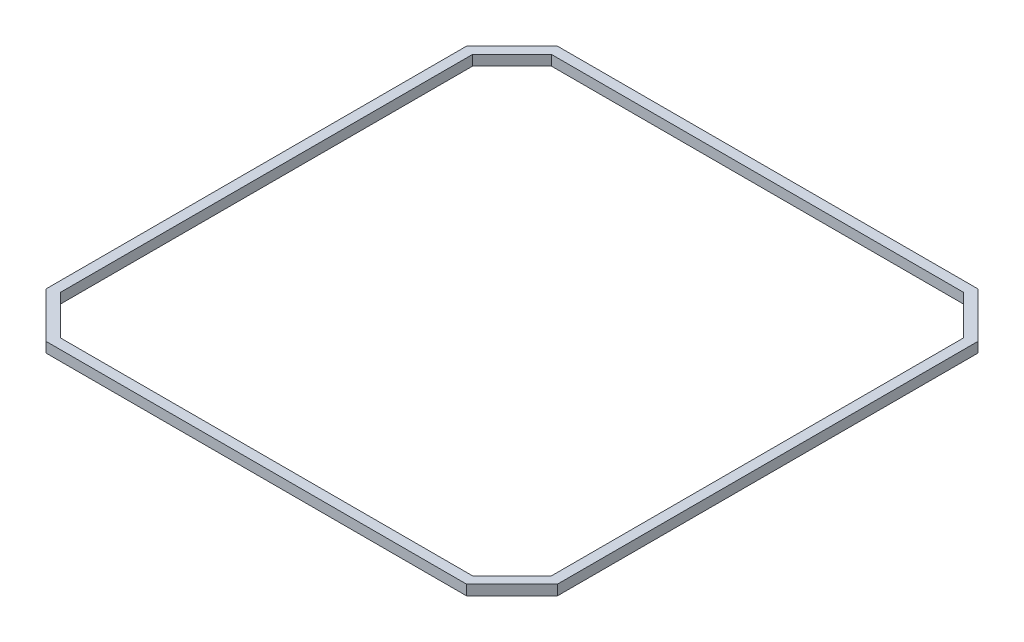
from build123d import *

# Parameters (mm, degrees)
BOSS_EXTRUDE1_DEPTH = 1.65


with BuildPart() as part:
    # Sketch1 → Boss-Extrude1 (new body)
    with BuildSketch(Plane(origin=(0, 0, 0), x_dir=(1, 0, 0), z_dir=(0, 1, 0))):
        Polygon((-41.448800006, 34.091704203), (-34.091704203, 41.448800006), (34.091704203, 41.448800006), (41.448800006, 34.091704203), (41.448800006, -34.091704203), (34.091704203, -41.448800006), (-34.091704203, -41.448800006), (-41.448800006, -34.091704203), align=None)
        Polygon((-39.798800006, 33.408251825), (-33.408251825, 39.798800006), (33.408251825, 39.798800006), (39.798800006, 33.408251825), (39.798800006, -33.408251825), (33.408251825, -39.798800006), (-33.408251825, -39.798800006), (-39.798800006, -33.408251825), align=None, mode=Mode.SUBTRACT)
    extrude(amount=BOSS_EXTRUDE1_DEPTH)


solid = part.part
